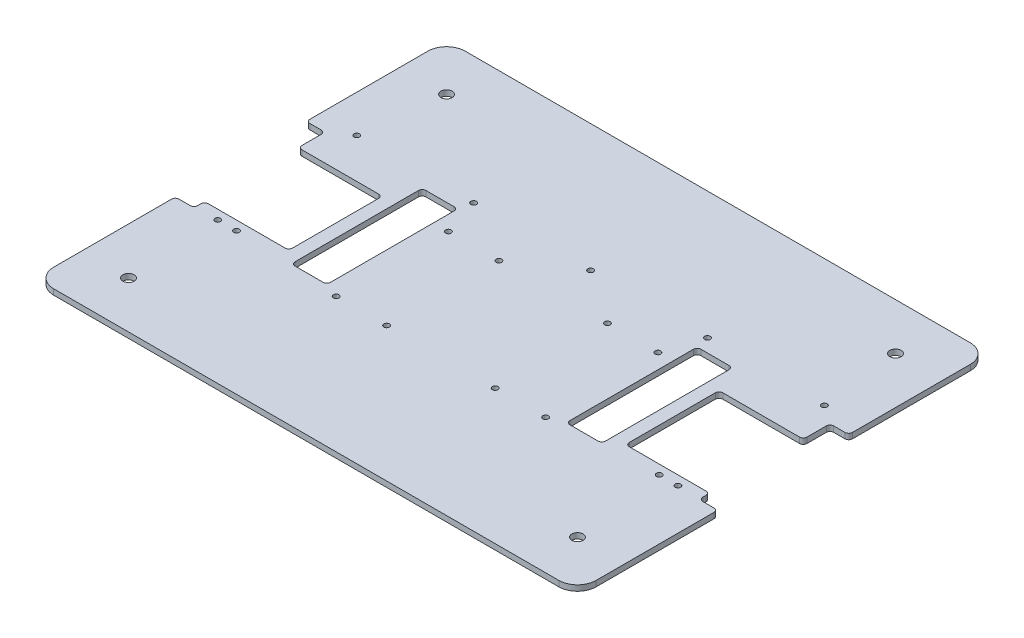
from build123d import *

# Parameters (mm, degrees)
SKETCH_1_W          = 290
SKETCH_1_H          = 220
EXTRUDE_1_DEPTH     = 3
SKETCH_2_R          = 1.5
SKETCH_2_R_2        = 3
SKETCH_2_W          = 19
SKETCH_2_H          = 70
CUT_EXTRUDE_1_DEPTH = 183.027470454
FILLET_1_R          = 10
FILLET_2_R          = 2


with BuildPart() as part:
    # Эскиз1 → Бобышка-Вытянуть1 (new body)
    with BuildSketch(Plane(origin=(0, 0, 0), x_dir=(1, 0, 0), z_dir=(0, 1, 0))):
        Rectangle(SKETCH_1_W, SKETCH_1_H)
    extrude(amount=EXTRUDE_1_DEPTH)

    # Эскиз2 → Вырез-Вытянуть1 (cut, through all)
    with BuildSketch(Plane(origin=(0, 3, 0), x_dir=(1, 0, 0), z_dir=(0, 1, 0))):
        with Locations(Location((-123, -34.3, 0), (0, 0, 270))):
            Circle(SKETCH_2_R)
        with Locations(Location((-113, -34.3, 0), (0, 0, 90))):
            Circle(SKETCH_2_R)
        with Locations(Location((123, -34.3, 0), (0, 0, 90))):
            Circle(SKETCH_2_R)
        with Locations(Location((113, -34.3, 0), (0, 0, 270))):
            Circle(SKETCH_2_R)
        with Locations(Location((-56, -38, 0), (0, 0, 270))):
            Circle(SKETCH_2_R)
        with Locations(Location((-29, -38, 0), (0, 0, 270))):
            Circle(SKETCH_2_R)
        with Locations(Location((-56, 22, 0), (0, 0, 270))):
            Circle(SKETCH_2_R)
        with Locations(Location((-29, 22, 0), (0, 0, 270))):
            Circle(SKETCH_2_R)
        with Locations(Location((56, -38, 0), (0, 0, 90))):
            Circle(SKETCH_2_R)
        with Locations(Location((29, -38, 0), (0, 0, 90))):
            Circle(SKETCH_2_R)
        with Locations(Location((29, 22, 0), (0, 0, 90))):
            Circle(SKETCH_2_R)
        with Locations(Location((56, 22, 0), (0, 0, 90))):
            Circle(SKETCH_2_R)
        with Locations(Location((-125, 42, 0), (0, 0, 270))):
            Circle(SKETCH_2_R)
        with Locations(Location((-62.5, 42, 0), (0, 0, 270))):
            Circle(SKETCH_2_R)
        with Locations(Location((0, 42, 0), (0, 0, 270))):
            Circle(SKETCH_2_R)
        with Locations(Location((125, 42, 0), (0, 0, 90))):
            Circle(SKETCH_2_R)
        with Locations(Location((62.5, 42, 0), (0, 0, 90))):
            Circle(SKETCH_2_R)
        with Locations(Location((-120, 85, 0), (0, 0, 270))):
            Circle(SKETCH_2_R_2)
        with Locations(Location((-120, -85, 0), (0, 0, 270))):
            Circle(SKETCH_2_R_2)
        with Locations(Location((120, 85, 0), (0, 0, 90))):
            Circle(SKETCH_2_R_2)
        with Locations(Location((120, -85, 0), (0, 0, 90))):
            Circle(SKETCH_2_R_2)
        Polygon((135, -35), (145, -35), (145, 35), (135, 35), (135, 20.7), (90, 20.7), (90, -29.3), (135, -29.3), align=None)
        Polygon((-135, -35), (-145, -35), (-145, 35), (-135, 35), (-135, 20.7), (-90, 20.7), (-90, -29.3), (-135, -29.3), align=None)
        with Locations((73.5, 0)):
            Rectangle(SKETCH_2_W, SKETCH_2_H)
        with Locations((-73.5, 0)):
            Rectangle(SKETCH_2_W, SKETCH_2_H)
    extrude(amount=-CUT_EXTRUDE_1_DEPTH, mode=Mode.SUBTRACT)

    # Скругление1
    fillet_1_edges = [part.edges().sort_by_distance(p)[0] for p in [
        (145, 1.5, 110),
        (-145, 1.5, 110),
        (-145, 1.5, -110),
        (145, 1.5, -110),
    ]]
    fillet(fillet_1_edges, radius=FILLET_1_R)

    # Скругление2
    fillet_2_edges = [part.edges().sort_by_distance(p)[0] for p in [
        (-145, 1.5, 35),
        (-145, 1.5, -35),
        (-135, 1.5, -35),
        (-135, 1.5, -20.7),
        (-90, 1.5, -20.7),
        (-90, 1.5, 29.3),
        (-135, 1.5, 29.3),
        (-135, 1.5, 35),
        (135, 1.5, 35),
        (135, 1.5, 29.3),
        (90, 1.5, 29.3),
        (90, 1.5, -20.7),
        (135, 1.5, -20.7),
        (135, 1.5, -35),
        (145, 1.5, -35),
        (145, 1.5, 35),
        (-64, 1.5, -35),
        (-64, 1.5, 35),
        (-83, 1.5, 35),
        (-83, 1.5, -35),
        (83, 1.5, -35),
        (83, 1.5, 35),
        (64, 1.5, 35),
        (64, 1.5, -35),
    ]]
    fillet(fillet_2_edges, radius=FILLET_2_R)


solid = part.part
